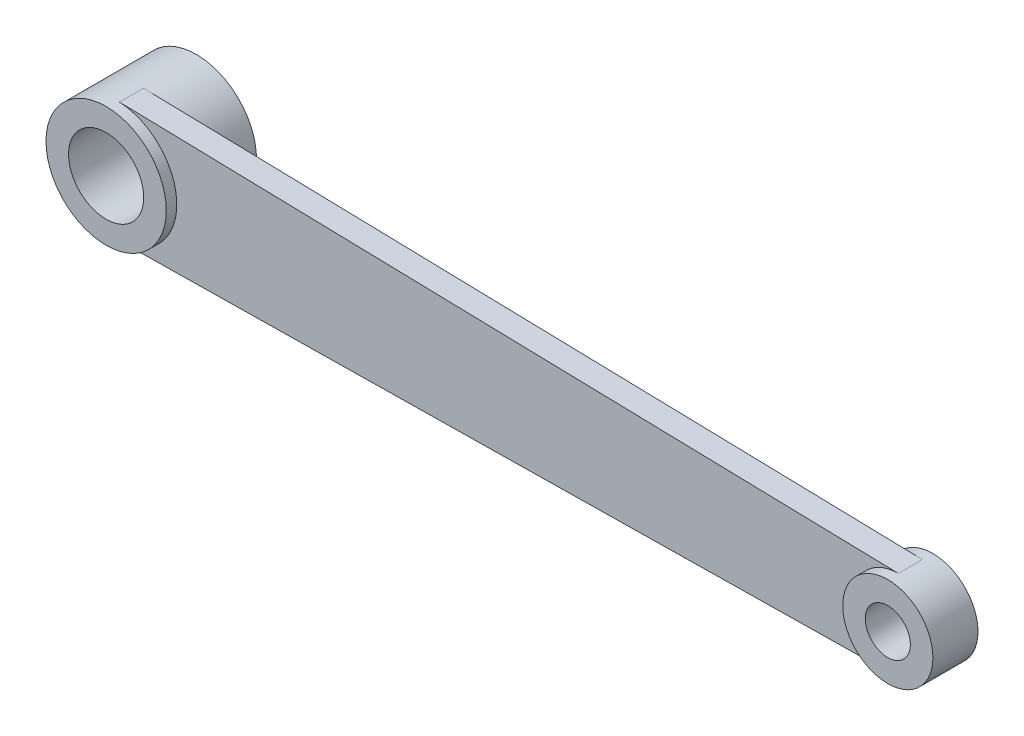
from build123d import *

# Parameters (mm, degrees)
BOSS_EXTRUDE1_DEPTH = 4
SKETCH2_R           = 20
SKETCH2_R_2         = 12.5
SKETCH2_R_3         = 15
SKETCH2_R_4         = 7.5
BOSS_EXTRUDE2_DEPTH = 7.5
SKETCH3_R           = 20
SKETCH3_R_2         = 12.5
BOSS_EXTRUDE3_DEPTH = 15


with BuildPart() as part:
    # Sketch1 → Boss-Extrude1 (new, symmetric)
    with BuildSketch(Plane.XY):
        with BuildLine():
            Line((59.81488788, 13.727342811), (-199.220649297, 19.976731751))
            ThreePointArc((-199.220649297, 19.976731751), (-185.706002057, 13.796933419), (-180.18511212, 0))
            ThreePointArc((-180.18511212, 0), (-185.84170962, -13.937962718), (-199.611792592, -19.991780929))
            Line((-199.611792592, -19.991780929), (59.81488788, -16.272657189))
            ThreePointArc((59.81488788, -16.272657189), (44.81488788, -1.272657189), (59.81488788, 13.727342811))
        make_face()
    extrude(amount=BOSS_EXTRUDE1_DEPTH, both=True)

    # Sketch2 → Boss-Extrude2 (add, symmetric)
    # profile 1 of 2: a face of its own
    with BuildSketch(Plane.XY):
        with Locations((-200.18511212, 0)):
            Circle(SKETCH2_R)
        with Locations((-200.18511212, 0)):
            Circle(SKETCH2_R_2, mode=Mode.SUBTRACT)
    # profile 2 of 2: a face of its own
    with BuildSketch(Plane.XY):
        with Locations((59.81488788, -1.272657189)):
            Circle(SKETCH2_R_3)
        with Locations((59.81488788, -1.272657189)):
            Circle(SKETCH2_R_4, mode=Mode.SUBTRACT)
    extrude(amount=BOSS_EXTRUDE2_DEPTH, both=True)

    # Sketch3 → Boss-Extrude3 (add)
    with BuildSketch(Plane(origin=(0, 0, -7.5), x_dir=(-1, 0, 0), z_dir=(0, 0, -1))):
        with Locations((200.18511212, 0)):
            Circle(SKETCH3_R)
        with Locations((200.18511212, 0)):
            Circle(SKETCH3_R_2, mode=Mode.SUBTRACT)
    extrude(amount=BOSS_EXTRUDE3_DEPTH)


solid = part.part
